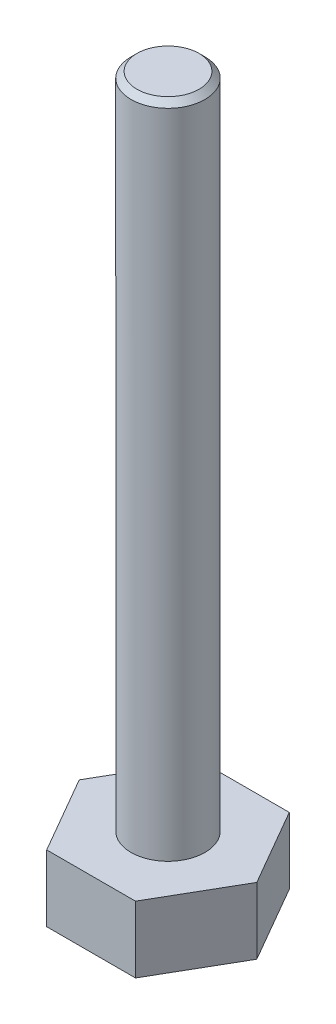
from build123d import *

# Parameters (mm, degrees)
SKETCH1_R           = 25
BOSS_EXTRUDE1_DEPTH = 45
SKETCH5_R           = 25
BOSS_EXTRUDE2_DEPTH = 490
CHAMFER1_SIZE       = 4


with BuildPart() as part:
    # Sketch1 → Boss-Extrude1 (new body)
    with BuildSketch(Plane(origin=(0, 0, 0), x_dir=(1, 0, 0), z_dir=(0, 1, 0))):
        Polygon((30.022213998, -52), (60.044427996, 0), (30.022213998, 52), (-30.022213998, 52), (-60.044427996, 0), (-30.022213998, -52), align=None)
        with Locations(Location((0, 0, 0), (0, 0, 90))):
            Circle(SKETCH1_R, mode=Mode.SUBTRACT)
    extrude(amount=BOSS_EXTRUDE1_DEPTH)

    # Sketch5 → Boss-Extrude2 (add)
    with BuildSketch(Plane.XZ):
        with Locations(Location((0, 0, 0), (0, 0, 270))):
            Circle(SKETCH5_R)
    extrude(amount=-BOSS_EXTRUDE2_DEPTH)

    # Chamfer1
    chamfer1_edges = [part.edges().sort_by_distance(p)[0] for p in [
        (0, 490, 25),
    ]]
    chamfer(chamfer1_edges, length=CHAMFER1_SIZE)


solid = part.part
